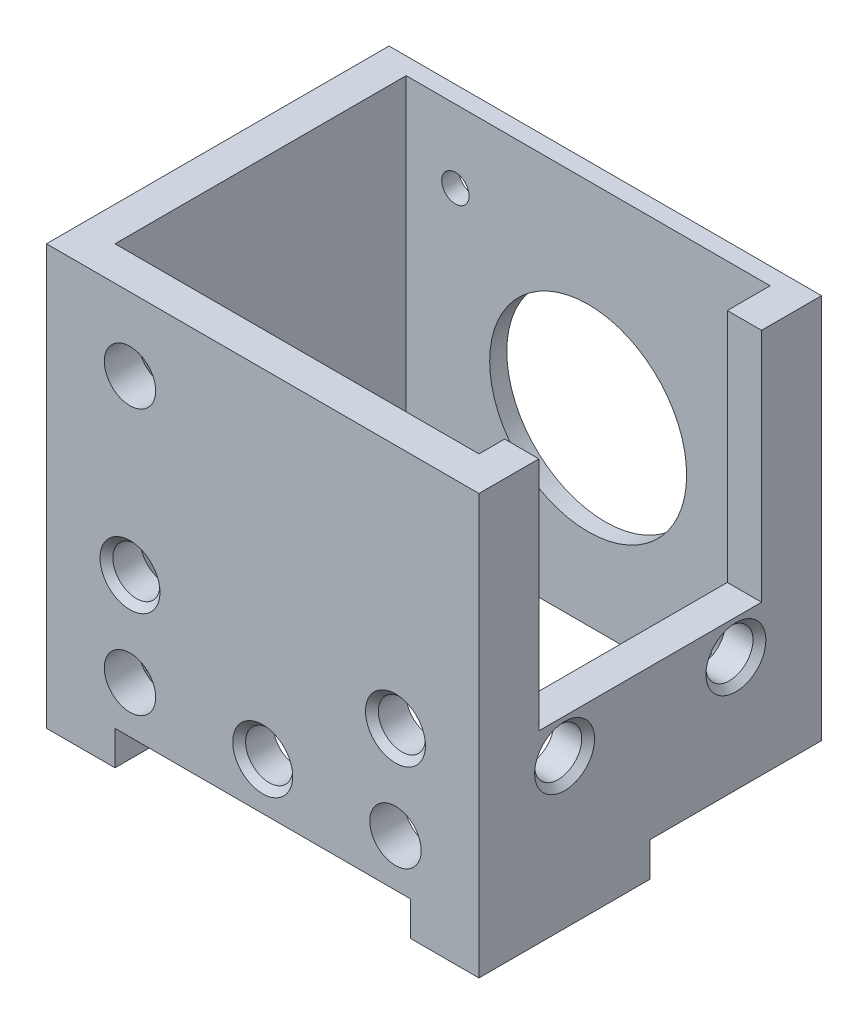
from build123d import *

# Parameters (mm, degrees)
SKETCH2_W           = 50.5
SKETCH2_H           = 40
SKETCH2_W_2         = 42.5
SKETCH2_H_2         = 34
BOSS_EXTRUDE1_DEPTH = 45
CUT_EXTRUDE1_REACH  = 72.825
SKETCH3_W           = 26
SKETCH3_H           = 27.5
CUT_EXTRUDE2_REACH  = 67.288
SKETCH4_R           = 11.5
SKETCH4_R_2         = 1.6
CUT_EXTRUDE3_REACH  = 67.288
SKETCH5_R           = 3
CUT_EXTRUDE4_REACH  = 67.288
SKETCH6_R           = 2.75
SKETCH7_R           = 2.75
CUT_EXTRUDE5_DEPTH  = 71.825489762
SKETCH8_W           = 8
SKETCH8_H           = 25
BOSS_EXTRUDE2_DEPTH = 4
SKETCH9_R           = 2.25
CUT_EXTRUDE6_DEPTH  = 4
CHAMFER1_SIZE       = 0.75


with BuildPart() as part:
    # Sketch2 → Boss-Extrude1 (new body)
    with BuildSketch(Plane(origin=(0, 0, 0), x_dir=(1, 0, 0), z_dir=(0, 1, 0))):
        with Locations((0, -1)):
            Rectangle(SKETCH2_W, SKETCH2_H)
        Rectangle(SKETCH2_W_2, SKETCH2_H_2, mode=Mode.SUBTRACT)
    extrude(amount=BOSS_EXTRUDE1_DEPTH)

    # Sketch3 → Cut-Extrude1 (cut, up to next)
    with BuildSketch(Plane(origin=(25.25, 0, 0), x_dir=(0, 0, -1), z_dir=(1, 0, 0)), mode=Mode.PRIVATE) as cut_extrude1_sk1:
        with Locations((-1, 31.25)):
            Rectangle(SKETCH3_W, SKETCH3_H)
    cut_extrude1_tool1 = extrude(cut_extrude1_sk1.sketch, amount=-CUT_EXTRUDE1_REACH, mode=Mode.PRIVATE) & part.part
    add(cut_extrude1_tool1.solids().sort_by_distance((25.25, 31.25, 1))[0], mode=Mode.SUBTRACT)

    # Sketch4 → Cut-Extrude2 (cut, up to next)
    with BuildSketch(Plane(origin=(0, 0, -19), x_dir=(-1, 0, 0), z_dir=(0, 0, -1)), mode=Mode.PRIVATE) as cut_extrude2_sk1:
        with Locations((0, 21)):
            Circle(SKETCH4_R)
    cut_extrude2_tool1 = extrude(cut_extrude2_sk1.sketch, amount=-CUT_EXTRUDE2_REACH, mode=Mode.PRIVATE) & part.part
    # Sketch4 → Cut-Extrude2 (cut, up to next)
    with BuildSketch(Plane(origin=(0, 0, -19), x_dir=(-1, 0, 0), z_dir=(0, 0, -1)), mode=Mode.PRIVATE) as cut_extrude2_sk2:
        with Locations((-15.5, 5.5)):
            Circle(SKETCH4_R_2)
    cut_extrude2_tool2 = extrude(cut_extrude2_sk2.sketch, amount=-CUT_EXTRUDE2_REACH, mode=Mode.PRIVATE) & part.part
    # Sketch4 → Cut-Extrude2 (cut, up to next)
    with BuildSketch(Plane(origin=(0, 0, -19), x_dir=(-1, 0, 0), z_dir=(0, 0, -1)), mode=Mode.PRIVATE) as cut_extrude2_sk3:
        with Locations((15.5, 5.5)):
            Circle(SKETCH4_R_2)
    cut_extrude2_tool3 = extrude(cut_extrude2_sk3.sketch, amount=-CUT_EXTRUDE2_REACH, mode=Mode.PRIVATE) & part.part
    # Sketch4 → Cut-Extrude2 (cut, up to next)
    with BuildSketch(Plane(origin=(0, 0, -19), x_dir=(-1, 0, 0), z_dir=(0, 0, -1)), mode=Mode.PRIVATE) as cut_extrude2_sk4:
        with Locations((15.5, 36.5)):
            Circle(SKETCH4_R_2)
    cut_extrude2_tool4 = extrude(cut_extrude2_sk4.sketch, amount=-CUT_EXTRUDE2_REACH, mode=Mode.PRIVATE) & part.part
    add(cut_extrude2_tool1.solids().sort_by_distance((0, 21, -19))[0], mode=Mode.SUBTRACT)
    add(cut_extrude2_tool2.solids().sort_by_distance((15.5, 5.5, -19))[0], mode=Mode.SUBTRACT)
    add(cut_extrude2_tool3.solids().sort_by_distance((-15.5, 5.5, -19))[0], mode=Mode.SUBTRACT)
    add(cut_extrude2_tool4.solids().sort_by_distance((-15.5, 36.5, -19))[0], mode=Mode.SUBTRACT)

    # Sketch5 → Cut-Extrude3 (cut, up to next)
    with BuildSketch(Plane.XY.offset(21), mode=Mode.PRIVATE) as cut_extrude3_sk1:
        with Locations((-15.5, 36.5)):
            Circle(SKETCH5_R)
    cut_extrude3_tool1 = extrude(cut_extrude3_sk1.sketch, amount=-CUT_EXTRUDE3_REACH, mode=Mode.PRIVATE) & part.part
    # Sketch5 → Cut-Extrude3 (cut, up to next)
    with BuildSketch(Plane.XY.offset(21), mode=Mode.PRIVATE) as cut_extrude3_sk2:
        with Locations((-15.5, 5.5)):
            Circle(SKETCH5_R)
    cut_extrude3_tool2 = extrude(cut_extrude3_sk2.sketch, amount=-CUT_EXTRUDE3_REACH, mode=Mode.PRIVATE) & part.part
    # Sketch5 → Cut-Extrude3 (cut, up to next)
    with BuildSketch(Plane.XY.offset(21), mode=Mode.PRIVATE) as cut_extrude3_sk3:
        with Locations((15.5, 5.5)):
            Circle(SKETCH5_R)
    cut_extrude3_tool3 = extrude(cut_extrude3_sk3.sketch, amount=-CUT_EXTRUDE3_REACH, mode=Mode.PRIVATE) & part.part
    add(cut_extrude3_tool1.solids().sort_by_distance((-15.5, 36.5, 21))[0], mode=Mode.SUBTRACT)
    add(cut_extrude3_tool2.solids().sort_by_distance((-15.5, 5.5, 21))[0], mode=Mode.SUBTRACT)
    add(cut_extrude3_tool3.solids().sort_by_distance((15.5, 5.5, 21))[0], mode=Mode.SUBTRACT)

    # Sketch6 → Cut-Extrude4 (cut, up to next)
    with BuildSketch(Plane.XY.offset(21), mode=Mode.PRIVATE) as cut_extrude4_sk1:
        with Locations((-15.5, 16.365063509)):
            Circle(SKETCH6_R)
    cut_extrude4_tool1 = extrude(cut_extrude4_sk1.sketch, amount=-CUT_EXTRUDE4_REACH, mode=Mode.PRIVATE) & part.part
    # Sketch6 → Cut-Extrude4 (cut, up to next)
    with BuildSketch(Plane.XY.offset(21), mode=Mode.PRIVATE) as cut_extrude4_sk2:
        with Locations((0, 5.5)):
            Circle(SKETCH6_R)
    cut_extrude4_tool2 = extrude(cut_extrude4_sk2.sketch, amount=-CUT_EXTRUDE4_REACH, mode=Mode.PRIVATE) & part.part
    # Sketch6 → Cut-Extrude4 (cut, up to next)
    with BuildSketch(Plane.XY.offset(21), mode=Mode.PRIVATE) as cut_extrude4_sk3:
        with Locations((15.5, 16.365063509)):
            Circle(SKETCH6_R)
    cut_extrude4_tool3 = extrude(cut_extrude4_sk3.sketch, amount=-CUT_EXTRUDE4_REACH, mode=Mode.PRIVATE) & part.part
    add(cut_extrude4_tool1.solids().sort_by_distance((-15.5, 16.365064, 21))[0], mode=Mode.SUBTRACT)
    add(cut_extrude4_tool2.solids().sort_by_distance((0, 5.5, 21))[0], mode=Mode.SUBTRACT)
    add(cut_extrude4_tool3.solids().sort_by_distance((15.5, 16.365064, 21))[0], mode=Mode.SUBTRACT)

    # Sketch7 → Cut-Extrude5 (cut, through all)
    with BuildSketch(Plane(origin=(25.25, 0, 0), x_dir=(0, 0, -1), z_dir=(1, 0, 0))):
        with Locations((-11, 13.440603491)):
            Circle(SKETCH7_R)
        with Locations((9, 13.440603491)):
            Circle(SKETCH7_R)
    extrude(amount=-CUT_EXTRUDE5_DEPTH, mode=Mode.SUBTRACT)

    # Sketch8 → Boss-Extrude2 (add)
    with BuildSketch(Plane.XZ):
        Polygon((19, 1), (17.25, 11), (17.25, 21), (25.25, 21), (25.25, 1), align=None)
        with Locations((-21.25, 8.5)):
            Rectangle(SKETCH8_W, SKETCH8_H)
    extrude(amount=BOSS_EXTRUDE2_DEPTH)

    # Sketch9 → Cut-Extrude6 (cut)
    with BuildSketch(Plane.XZ.offset(4)):
        with Locations(Location((-21.25, 13, 0), (0, 0, 270))):
            Circle(SKETCH9_R)
        with Locations(Location((-21.25, 0.5, 0), (0, 0, 270))):
            Circle(SKETCH9_R)
        with Locations(Location((21.25, 6, 0), (0, 0, 270))):
            Circle(SKETCH9_R)
        with Locations(Location((21.25, 16, 0), (0, 0, 270))):
            Circle(SKETCH9_R)
    extrude(amount=-CUT_EXTRUDE6_DEPTH, mode=Mode.SUBTRACT)

    # Chamfer1
    chamfer1_edges = [part.edges().sort_by_distance(p)[0] for p in [
        (21.25, -4, 18.25),
        (21.25, -4, 8.25),
        (-21.25, -4, 2.75),
        (-21.25, -4, 15.25),
        (-18.25, 16.365063509, 21),
        (-2.75, 5.5, 21),
        (12.75, 16.365063509, 21),
        (-25.25, 13.440603491, 13.75),
        (25.25, 13.440603491, 13.75),
        (-25.25, 13.440603491, -6.25),
        (25.25, 13.440603491, -6.25),
    ]]
    chamfer(chamfer1_edges, length=CHAMFER1_SIZE)


solid = part.part
